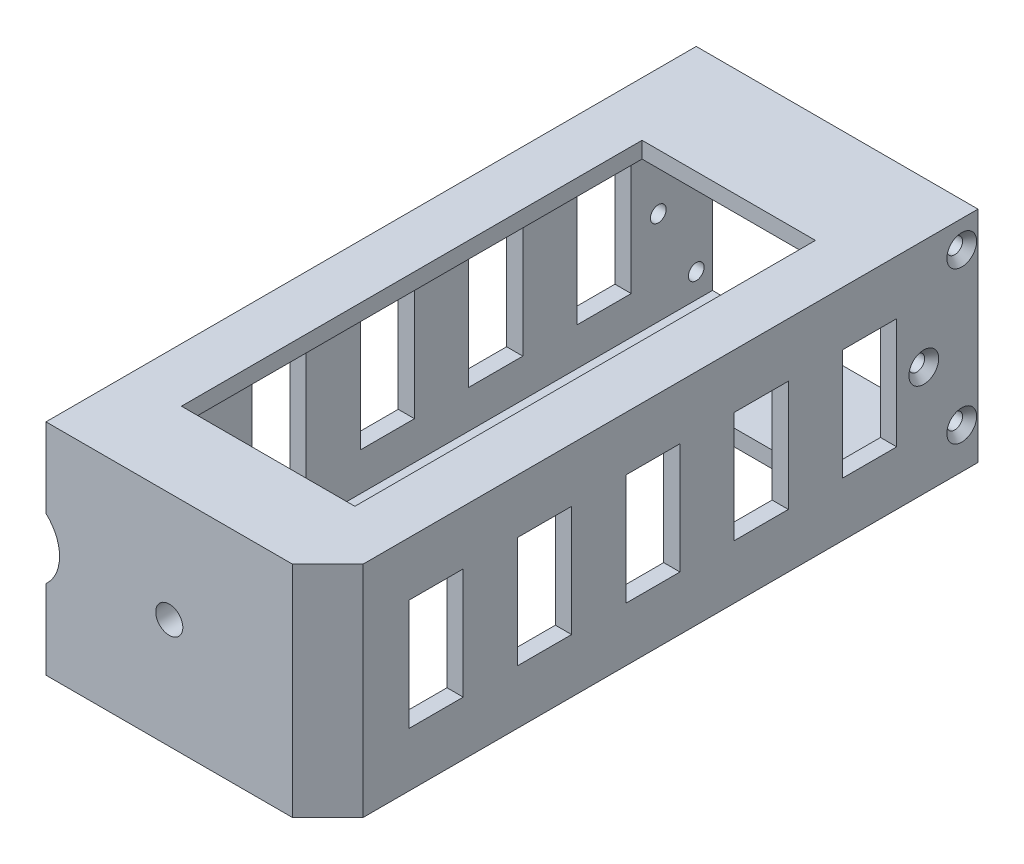
from build123d import *

# Parameters (mm, degrees)
MAIN_SKETCH_W                                    = 52
MAIN_SKETCH_H                                    = 40.5
MAIN_EXTRUSION_DEPTH                             = 120
MAIN_HOLE_START                                  = -112
MAIN_HOLE_SKETCH_W                               = 46
MAIN_HOLE_SKETCH_H                               = 34.5
MAIN_HOLE_DEPTH                                  = 112
FRAISAGE_POUR_VIS_T_TE_FRAIS_E_M2_51_D           = 2.9
FRAISAGE_POUR_VIS_T_TE_FRAIS_E_M2_51_CSINK_D     = 5.5
FRAISAGE_POUR_VIS_T_TE_FRAIS_E_M2_51_CSINK_ANGLE = 90
ESQUISSE6_W                                      = 10
ESQUISSE6_H                                      = 20.5
ENL_V_MAT_EXTRU_3_DEPTH                          = 133.340706134
ESQUISSE7_W                                      = 32
ESQUISSE7_H                                      = 85
ENL_V_MAT_EXTRU_4_DEPTH                          = 130.291337684
R_P_TITION_LIN_AIRE1_COUNT                       = 5
R_P_TITION_LIN_AIRE1_PITCH                       = 20
ENL_V_MAT_EXTRU_5_DEPTH                          = 130.291337684
ESQUISSE10_R                                     = 7.5
ENL_V_MAT_EXTRU_7_DEPTH                          = 4
FRAISAGE_POUR_VIS_T_TE_FRAIS_E_M2_52_D           = 2.9
FRAISAGE_POUR_VIS_T_TE_FRAIS_E_M2_52_CSINK_D     = 5.5
FRAISAGE_POUR_VIS_T_TE_FRAIS_E_M2_52_CSINK_ANGLE = 90
R_P_TITION_LIN_AIRE3_COUNT                       = 2
R_P_TITION_LIN_AIRE3_PITCH                       = 28
ENL_V_MAT_EXTRU_8_REACH                          = 126.443
ESQUISSE13_R                                     = 2.5


with BuildPart() as part:
    # Main-Sketch → Main-Extrusion (new body)
    with BuildSketch(Plane.XY):
        Rectangle(MAIN_SKETCH_W, MAIN_SKETCH_H)
    extrude(amount=MAIN_EXTRUSION_DEPTH)

    # Main-Hole-Sketch → Main-Hole (cut)
    with BuildSketch(Plane(origin=(0, 0, 0), x_dir=(-1, 0, 0), z_dir=(0, 0, -1)).offset(MAIN_HOLE_START)):
        Rectangle(MAIN_HOLE_SKETCH_W, MAIN_HOLE_SKETCH_H)
    extrude(amount=MAIN_HOLE_DEPTH, mode=Mode.SUBTRACT)

    # Fraisage pour vis à tête fraisée M2.51 (through all)
    with Locations(Plane(origin=(26, 0, 0), x_dir=(0, 0, -1), z_dir=(1, 0, 0))):
        with Locations((-10, 0)):
            CounterSinkHole(FRAISAGE_POUR_VIS_T_TE_FRAIS_E_M2_51_D / 2, FRAISAGE_POUR_VIS_T_TE_FRAIS_E_M2_51_CSINK_D / 2, counter_sink_angle=FRAISAGE_POUR_VIS_T_TE_FRAIS_E_M2_51_CSINK_ANGLE)

    # Esquisse6 → Enlèv. mat.-Extru.3 (cut, through all)
    with BuildSketch(Plane(origin=(26, 0, 0), x_dir=(0, 0, -1), z_dir=(1, 0, 0))):
        with Locations((-100, 0)):
            Rectangle(ESQUISSE6_W, ESQUISSE6_H)
    enl_v_mat_extru_3 = extrude(amount=-ENL_V_MAT_EXTRU_3_DEPTH, mode=Mode.SUBTRACT)

    # Esquisse7 → Enlèv. mat.-Extru.4 (cut, through all)
    with BuildSketch(Plane(origin=(0, 20.25, 0), x_dir=(1, 0, 0), z_dir=(0, 1, 0))):
        with Locations((0, -62.5)):
            Rectangle(ESQUISSE7_W, ESQUISSE7_H)
    extrude(amount=-ENL_V_MAT_EXTRU_4_DEPTH, mode=Mode.SUBTRACT)

    # Répétition linéaire1: Enlèv. mat.-Extru.3 ×5
    with Locations(*[(0, 0, -i * R_P_TITION_LIN_AIRE1_PITCH) for i in range(1, R_P_TITION_LIN_AIRE1_COUNT)]):
        add(enl_v_mat_extru_3, mode=Mode.SUBTRACT)

    # Esquisse8 → Enlèv. mat.-Extru.5 (cut, through all)
    with BuildSketch(Plane(origin=(0, 20.25, 0), x_dir=(-1, 0, 0), z_dir=(0, 1, 0))):
        Polygon((-19.5, 120), (-26, 113.5), (-26, 120), align=None)
    extrude(amount=-ENL_V_MAT_EXTRU_5_DEPTH, mode=Mode.SUBTRACT)

    # Esquisse10 → Enlèv. mat.-Extru.7 (cut)
    with BuildSketch(Plane.XY.offset(120)):
        with Locations((-31, 0)):
            Circle(ESQUISSE10_R)
    extrude(amount=-ENL_V_MAT_EXTRU_7_DEPTH, mode=Mode.SUBTRACT)

    # Fraisage pour vis à tête fraisée M2.52 (through all)
    with Locations(Plane(origin=(26, 0, 0), x_dir=(0, 0, -1), z_dir=(1, 0, 0))):
        with Locations((-3, 15.25)):
            fraisage_pour_vis_t_te_frais_e_m2_52 = CounterSinkHole(FRAISAGE_POUR_VIS_T_TE_FRAIS_E_M2_52_D / 2, FRAISAGE_POUR_VIS_T_TE_FRAIS_E_M2_52_CSINK_D / 2, counter_sink_angle=FRAISAGE_POUR_VIS_T_TE_FRAIS_E_M2_52_CSINK_ANGLE)

    # Répétition linéaire3: Fraisage pour vis à tête fraisée M2.52 ×2
    with Locations(*[(0, -i * R_P_TITION_LIN_AIRE3_PITCH, 0) for i in range(1, R_P_TITION_LIN_AIRE3_COUNT)]):
        add(fraisage_pour_vis_t_te_frais_e_m2_52, mode=Mode.SUBTRACT)

    # Esquisse13 → Enlèv. mat.-Extru.8 (cut, up to next)
    with BuildSketch(Plane.XY.offset(120), mode=Mode.PRIVATE) as enl_v_mat_extru_8_sk1:
        with Locations((-3.25, 0)):
            Circle(ESQUISSE13_R)
    enl_v_mat_extru_8_tool1 = extrude(enl_v_mat_extru_8_sk1.sketch, amount=-ENL_V_MAT_EXTRU_8_REACH, mode=Mode.PRIVATE) & part.part
    add(enl_v_mat_extru_8_tool1.solids().sort_by_distance((-3.25, 0, 120))[0], mode=Mode.SUBTRACT)


solid = part.part
